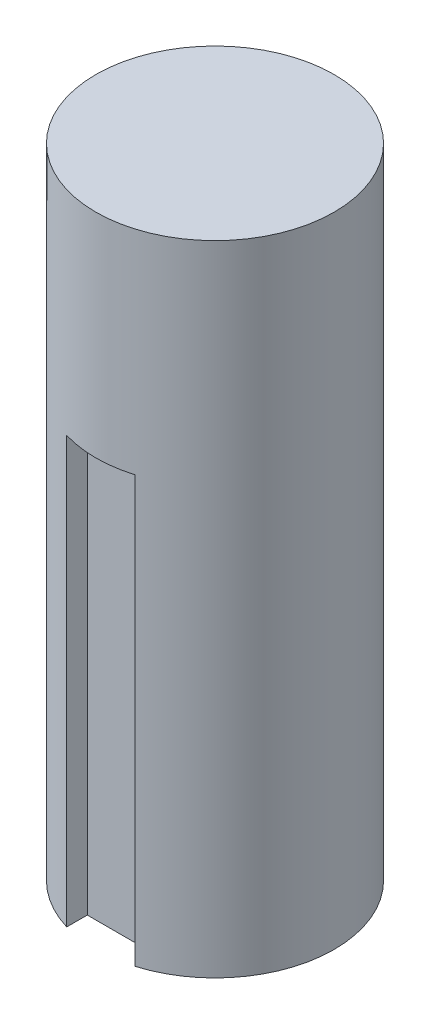
from build123d import *

# Parameters (mm, degrees)
SKETCH1_R           = 28
BOSS_EXTRUDE1_DEPTH = 150
SKETCH2_W           = 16
SKETCH2_H           = 6
CUT_EXTRUDE1_DEPTH  = 100


with BuildPart() as part:
    # Sketch1 → Boss-Extrude1 (new body)
    with BuildSketch(Plane(origin=(0, 0, 0), x_dir=(1, 0, 0), z_dir=(0, 1, 0))):
        with Locations(Location((0, 0, 0), (0, 0, 270))):
            Circle(SKETCH1_R)
    extrude(amount=BOSS_EXTRUDE1_DEPTH)

    # Sketch2 → Cut-Extrude1 (cut)
    with BuildSketch(Plane.XZ):
        with Locations((0, 25)):
            Rectangle(SKETCH2_W, SKETCH2_H)
    extrude(amount=-CUT_EXTRUDE1_DEPTH, mode=Mode.SUBTRACT)


solid = part.part
